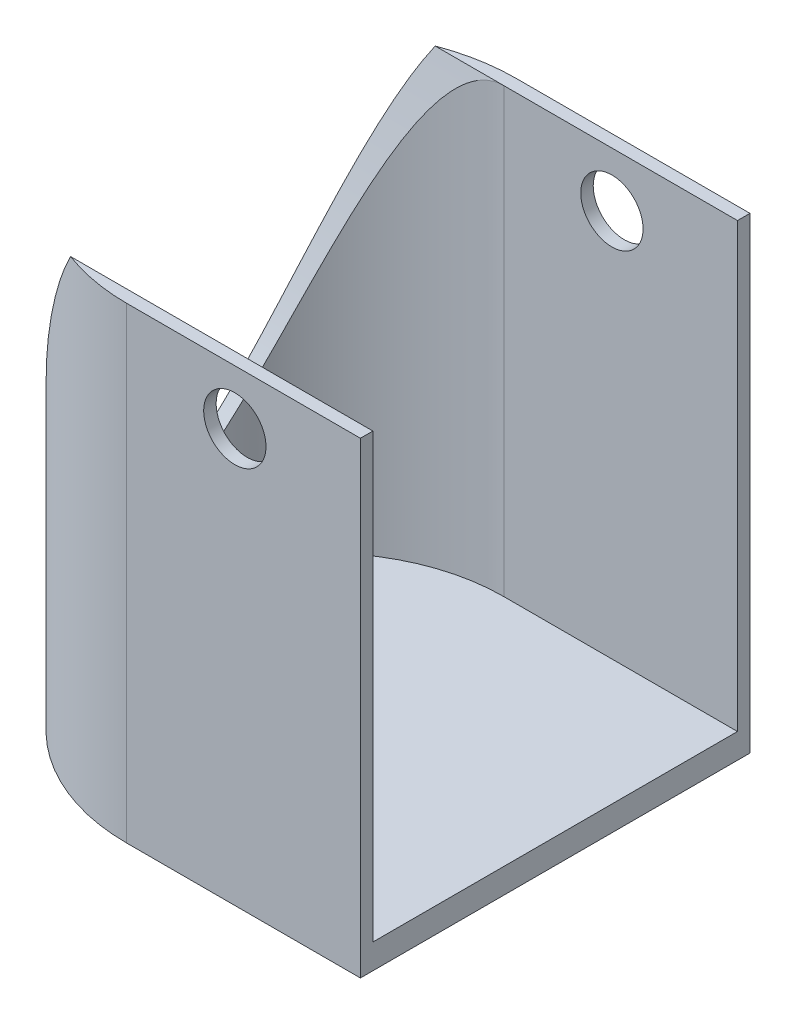
from build123d import *

# Parameters (mm, degrees)
BOSS_EXTRUDE2_DEPTH     = 30
BOSS_EXTRUDE3_DEPTH     = 1.6
CUT_EXTRUDE2_REACH      = 37.795
CUT_EXTRUDE3_REACH      = 37.795
SKETCH4_R               = 2
CUT_EXTRUDE4_DEPTH      = 42.833001458
CUT_EXTRUDE4_DEPTH_BACK = 42.833001458
SKETCH5_R               = 2


with BuildPart() as part:
    # Sketch1 → Boss-Extrude2 (new body)
    with BuildSketch(Plane(origin=(0, 0, 0), x_dir=(1, 0, 0), z_dir=(0, 1, 0))):
        with BuildLine():
            ThreePointArc((0, -11.7), (-11.7, 0), (0, 11.7))
            Line((0, 11.7), (13.4, 11.7))
            Line((13.4, 11.7), (15, 11.7))
            Line((15, 11.7), (15, 12.5))
            Line((15, 12.5), (0, 12.5))
            ThreePointArc((0, 12.5), (-12.5, 0), (0, -12.5))
            Line((0, -12.5), (15, -12.5))
            Line((15, -12.5), (15, -11.7))
            Line((15, -11.7), (13.4, -11.7))
            Line((13.4, -11.7), (0, -11.7))
        make_face()
    extrude(amount=BOSS_EXTRUDE2_DEPTH)

    # Sketch1<5> → Boss-Extrude3 (add)
    with BuildSketch(Plane(origin=(0, 0, 0), x_dir=(1, 0, 0), z_dir=(0, 1, 0))):
        with BuildLine():
            ThreePointArc((0, 11.7), (-11.7, 0), (0, -11.7))
            Line((0, -11.7), (15, -11.7))
            Line((15, -11.7), (15, 11.7))
            Line((15, 11.7), (0, 11.7))
        make_face()
    extrude(amount=BOSS_EXTRUDE3_DEPTH)

    # Sketch3 → Cut-Extrude2 (cut, up to next)
    with BuildSketch(Plane(origin=(0, 0, 0), x_dir=(0, 0, -1), z_dir=(1, 0, 0)), mode=Mode.PRIVATE) as cut_extrude2_sk1:
        with BuildLine():
            Line((-11.7, 30), (11.7, 30))
            add(Edge.make_bspline(
                [(-11.7, 30), (0, -19.413885882), (11.7, 30)],
                knots=[0, 0, 0, 1, 1, 1], degree=2))
        make_face()
    cut_extrude2_tool1 = extrude(cut_extrude2_sk1.sketch, amount=-CUT_EXTRUDE2_REACH, mode=Mode.PRIVATE) & part.part
    add(cut_extrude2_tool1.solids().sort_by_distance((0, 20.117223, 0))[0], mode=Mode.SUBTRACT)

    # Sketch4 → Cut-Extrude3 (cut, up to next)
    with BuildSketch(Plane.XZ, mode=Mode.PRIVATE) as cut_extrude3_sk1:
        Circle(SKETCH4_R)
    cut_extrude3_tool1 = extrude(cut_extrude3_sk1.sketch, amount=-CUT_EXTRUDE3_REACH, mode=Mode.PRIVATE) & part.part
    add(cut_extrude3_tool1.solids().sort_by_distance((0, 0, 0))[0], mode=Mode.SUBTRACT)

    # Sketch5 → Cut-Extrude4 (cut, two sides: drawn at the far end of the back side and taken through both)
    with BuildSketch(Plane(origin=(0, 0, -12.5), x_dir=(-1, 0, 0), z_dir=(0, 0, -1)).offset(-CUT_EXTRUDE4_DEPTH_BACK)):
        with Locations((-6.940962405, 26.50064478)):
            Circle(SKETCH5_R)
    extrude(amount=CUT_EXTRUDE4_DEPTH + CUT_EXTRUDE4_DEPTH_BACK, mode=Mode.SUBTRACT)


solid = part.part
